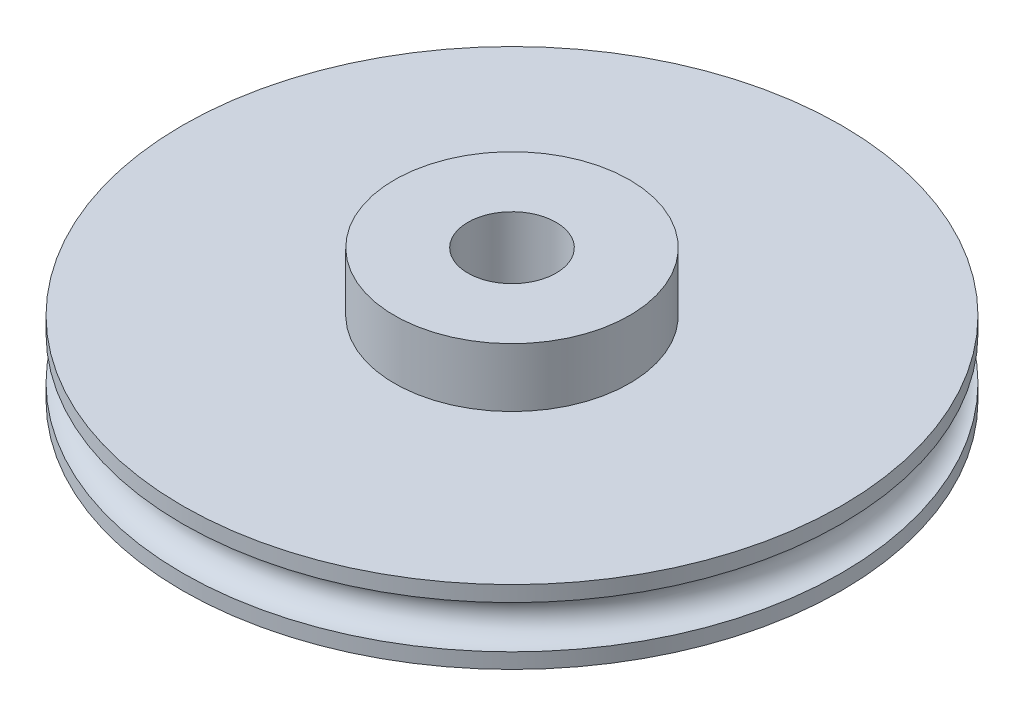
from build123d import *


with BuildPart() as part:
    # Esquisse1 → Révolution1 (revolve)
    with BuildSketch(Plane.XY, mode=Mode.PRIVATE) as r_volution1_sk:
        with BuildLine():
            ThreePointArc((22.42, 3.937322098), (20.97, 2.487322098), (22.42, 1.037322098))
            Line((22.42, 1.037322098), (22.42, 0))
            Line((22.42, 0), (23.97, 0))
            Line((23.97, 0), (3, 0))
            Line((3, 0), (3, 5))
            Line((3, 5), (3, 9))
            Line((3, 9), (8, 9))
            Line((8, 9), (8, 5))
            Line((8, 5), (23.97, 5))
            Line((23.97, 5), (22.42, 5))
            Line((22.42, 5), (22.42, 3.937322098))
        make_face()
    revolve(r_volution1_sk.sketch.rotate(Axis((0, 0, 0), (0, 1, 0)), 90), axis=Axis((0, 0, 0), (0, 1, 0)))


solid = part.part
